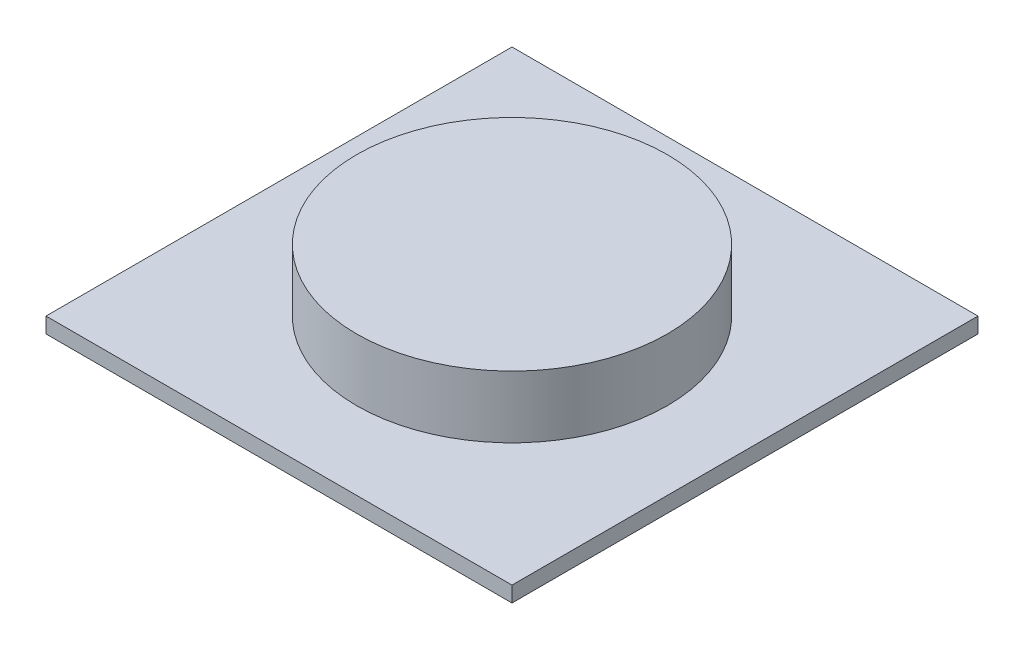
from build123d import *

# Parameters (mm, degrees)
SKETCH1_W           = 75
SKETCH1_H           = 75
BOSS_EXTRUDE1_DEPTH = 2.5
SKETCH2_R           = 25
BOSS_EXTRUDE2_DEPTH = 10


with BuildPart() as part:
    # Sketch1 → Boss-Extrude1 (new body)
    with BuildSketch(Plane(origin=(0, 0, 0), x_dir=(1, 0, 0), z_dir=(0, 1, 0))):
        Rectangle(SKETCH1_W, SKETCH1_H)
    extrude(amount=BOSS_EXTRUDE1_DEPTH)

    # Sketch2 → Boss-Extrude2 (add)
    with BuildSketch(Plane(origin=(0, 2.5, 0), x_dir=(1, 0, 0), z_dir=(0, 1, 0))):
        with Locations(Location((0, 0, 0), (0, 0, 270))):
            Circle(SKETCH2_R)
    extrude(amount=BOSS_EXTRUDE2_DEPTH)


solid = part.part
